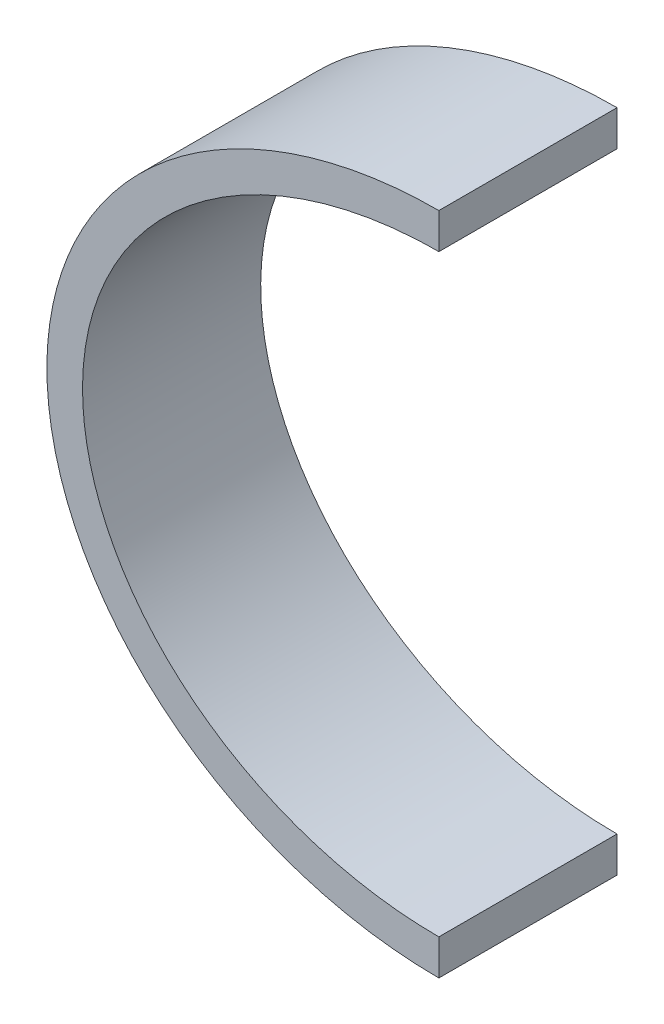
from build123d import *

# Parameters (mm, degrees)
BOSS_EXTRUDE1_DEPTH = 5


with BuildPart() as part:
    # Sketch1 → Boss-Extrude1 (new body)
    with BuildSketch(Plane.XY):
        with BuildLine():
            Line((0, 9.326086957), (0, 8.326086957))
            add(Edge.make_bspline(
                [(0, 8.326086957), (-10, 8.326086957), (-10, 0), (-10, -8.326086957), (0, -8.326086957)],
                knots=[4.71238898, 4.71238898, 4.71238898, 6.283185307, 6.283185307, 7.853981634, 7.853981634, 7.853981634], degree=2, weights=[1, 0.707106781, 1, 0.707106781, 1]))
            Line((0, -8.326086957), (0, -9.326086957))
            add(Edge.make_bspline(
                [(0, 9.326086957), (-11, 9.326086957), (-11, 0), (-11, -9.326086957), (0, -9.326086957)],
                knots=[4.71238898, 4.71238898, 4.71238898, 6.283185307, 6.283185307, 7.853981634, 7.853981634, 7.853981634], degree=2, weights=[1, 0.707106781, 1, 0.707106781, 1]))
        make_face()
    extrude(amount=BOSS_EXTRUDE1_DEPTH)


solid = part.part
